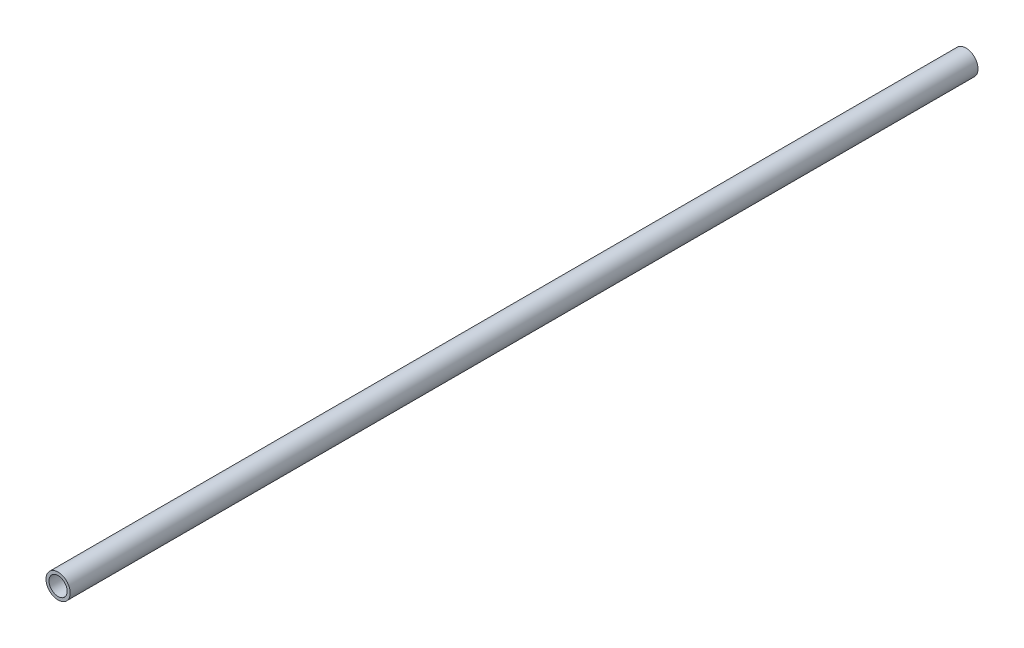
from build123d import *

# Parameters (mm, degrees)
SKETCH_1_R      = 4
SKETCH_1_R_2    = 3
EXTRUDE_1_DEPTH = 300


with BuildPart() as part:
    # 草图1 → 拉伸-薄壁1 (new body)
    with BuildSketch(Plane.XY):
        Circle(SKETCH_1_R)
        Circle(SKETCH_1_R_2, mode=Mode.SUBTRACT)
    extrude(amount=EXTRUDE_1_DEPTH)


solid = part.part
